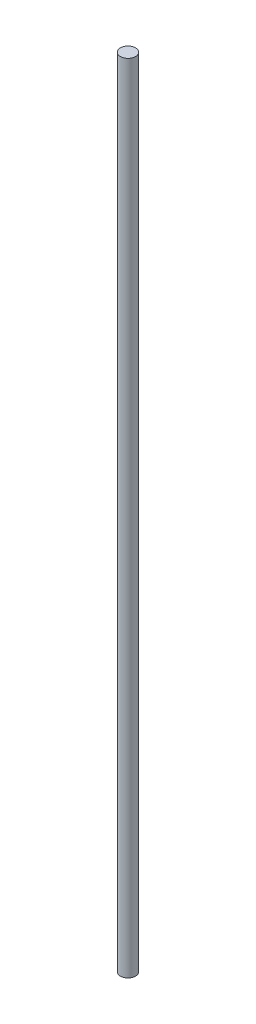
from build123d import *

# Parameters (mm, degrees)
SKETCH1_R           = 2
BOSS_EXTRUDE1_DEPTH = 210


with BuildPart() as part:
    # Sketch1 → Boss-Extrude1 (new body)
    with BuildSketch(Plane(origin=(0, 0, 0), x_dir=(1, 0, 0), z_dir=(0, 1, 0))):
        with Locations(Location((-20.440122927, 20.57602509, 0), (0, 0, 270))):
            Circle(SKETCH1_R)
    extrude(amount=BOSS_EXTRUDE1_DEPTH)


solid = part.part
